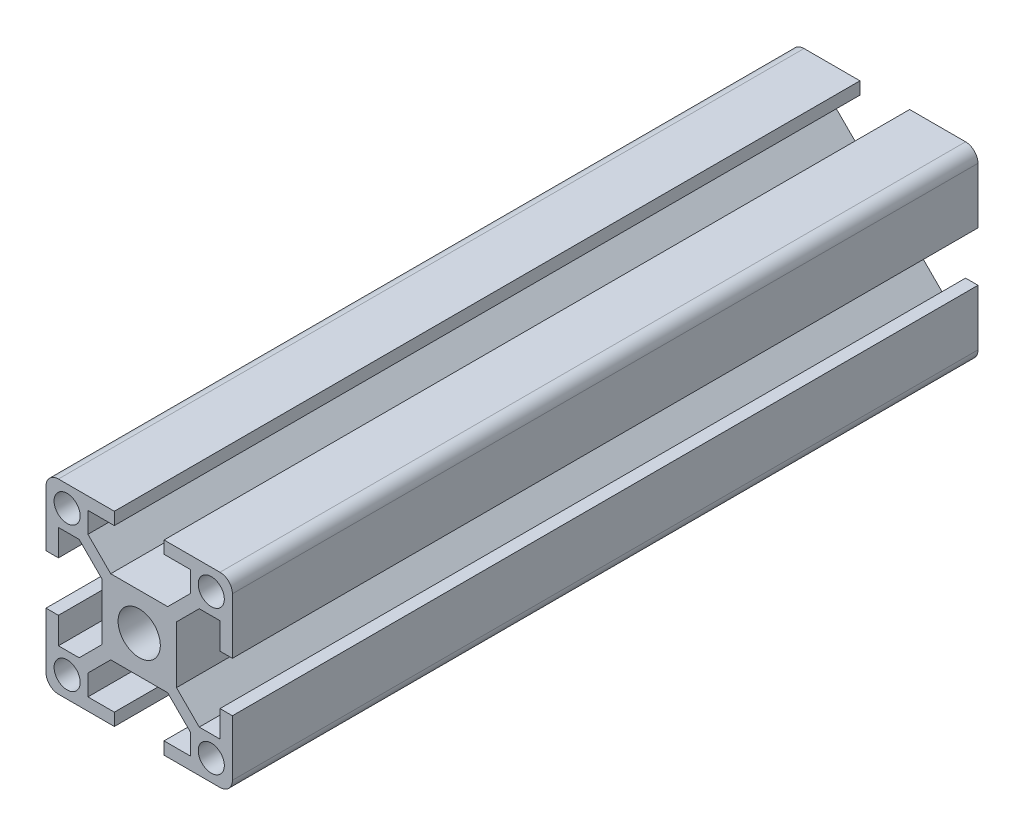
from build123d import *

# Parameters (mm, degrees)
SKETCH1_R           = 3.4
SKETCH1_R_2         = 2.1
BOSS_EXTRUDE1_DEPTH = 120
FILLET1_R           = 2


with BuildPart() as part:
    # Sketch1 → Boss-Extrude1 (new body)
    with BuildSketch(Plane.XY):
        Polygon((15, -15), (4, -15), (4, -13), (8.25, -13), (8.25, -9.664213562), (4.585786438, -6), (-4.585786438, -6), (-8.25, -9.664213562), (-8.25, -13), (-4, -13), (-4, -15), (-15, -15), (-15, -4), (-13, -4), (-13, -8.25), (-9.664213562, -8.25), (-6, -4.585786438), (-6, 4.585786438), (-9.664213562, 8.25), (-13, 8.25), (-13, 4), (-15, 4), (-15, 15), (-4, 15), (-4, 13), (-8.25, 13), (-8.25, 9.664213562), (-4.585786438, 6), (4.585786438, 6), (8.25, 9.664213562), (8.25, 13), (4, 13), (4, 15), (15, 15), (15, 4), (13, 4), (13, 8.25), (9.664213562, 8.25), (6, 4.585786438), (6, -4.585786438), (9.664213562, -8.25), (13, -8.25), (13, -4), (15, -4), align=None)
        Circle(SKETCH1_R, mode=Mode.SUBTRACT)
        with Locations((-11.6, 11.6)):
            Circle(SKETCH1_R_2, mode=Mode.SUBTRACT)
        with Locations((11.6, 11.6)):
            Circle(SKETCH1_R_2, mode=Mode.SUBTRACT)
        with Locations((11.6, -11.6)):
            Circle(SKETCH1_R_2, mode=Mode.SUBTRACT)
        with Locations((-11.6, -11.6)):
            Circle(SKETCH1_R_2, mode=Mode.SUBTRACT)
    extrude(amount=BOSS_EXTRUDE1_DEPTH)

    # Fillet1
    fillet1_edges = [part.edges().sort_by_distance(p)[0] for p in [
        (-15, -15, 60),
        (-15, 15, 60),
        (15, 15, 60),
        (15, -15, 60),
    ]]
    fillet(fillet1_edges, radius=FILLET1_R)


solid = part.part
